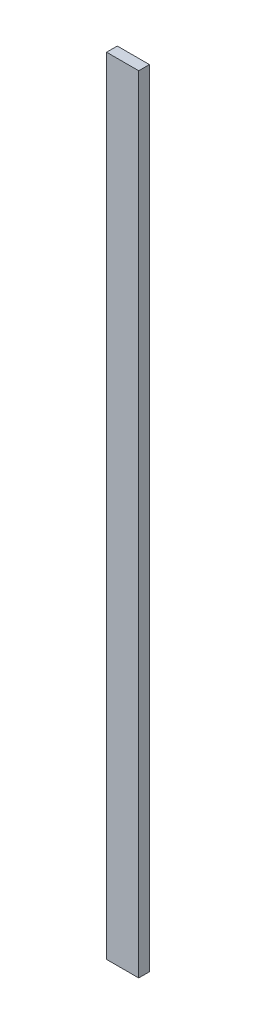
from build123d import *

# Parameters (mm, degrees)
SKETCH1_W           = 4.5
SKETCH1_H           = 1.5
BOSS_EXTRUDE1_DEPTH = 110


with BuildPart() as part:
    # Sketch1 → Boss-Extrude1 (new body)
    with BuildSketch(Plane(origin=(0, 0, 0), x_dir=(1, 0, 0), z_dir=(0, 1, 0))):
        Rectangle(SKETCH1_W, SKETCH1_H)
    extrude(amount=BOSS_EXTRUDE1_DEPTH)


solid = part.part
